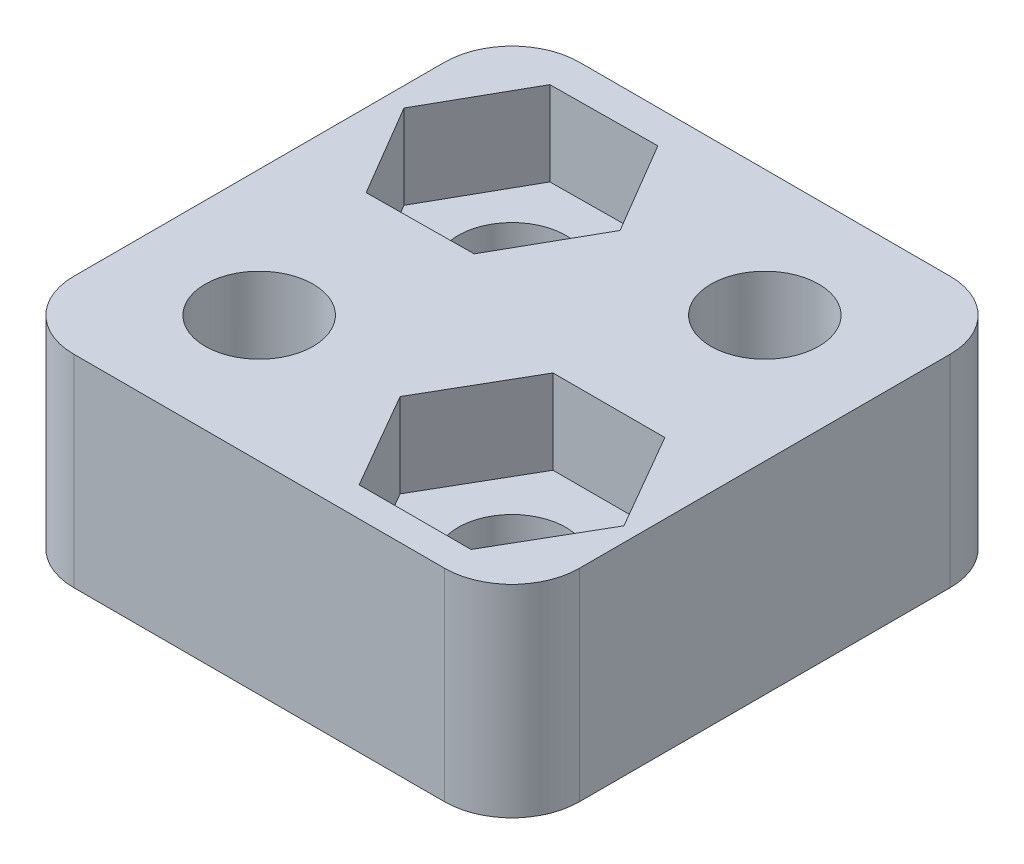
from build123d import *

# Parameters (mm, degrees)
SKETCH1_R           = 1.6
BOSS_EXTRUDE1_DEPTH = 6
CUT_EXTRUDE1_DEPTH  = 2.5
SKETCH3_R           = 2.75
CUT_EXTRUDE2_DEPTH  = 3
FILLET1_R           = 2


with BuildPart() as part:
    # Sketch1 → Boss-Extrude1 (new body)
    with BuildSketch(Plane(origin=(0, 0, 0), x_dir=(1, 0, 0), z_dir=(0, 1, 0))):
        Polygon((-7.472353521, 4.877749034), (-7.472353521, -6.298721554), (7.527646479, -6.298721554), (7.527646479, 8.701278446), (-7.472353521, 8.701278446), align=None)
        with Locations(Location((-3.722353521, 4.951278446, 0), (0, 0, 270))):
            Circle(SKETCH1_R, mode=Mode.SUBTRACT)
        with Locations(Location((3.777646479, -2.548721554, 0), (0, 0, 270))):
            Circle(SKETCH1_R, mode=Mode.SUBTRACT)
        with Locations(Location((3.777646479, 4.951278446, 0), (0, 0, 270))):
            Circle(SKETCH1_R, mode=Mode.SUBTRACT)
        with Locations(Location((-3.722353521, -2.548721554, 0), (0, 0, 270))):
            Circle(SKETCH1_R, mode=Mode.SUBTRACT)
    extrude(amount=BOSS_EXTRUDE1_DEPTH)

    # Sketch2 → Cut-Extrude1 (cut)
    with BuildSketch(Plane(origin=(0, 6, 0), x_dir=(1, 0, 0), z_dir=(0, 1, 0))):
        Polygon((-2.109264929, 2.216085852), (-0.547062955, 4.980657848), (-2.160151547, 7.715850442), (-5.335442114, 7.686471039), (-6.897644088, 4.921899043), (-5.284555496, 2.186706449), align=None)
        Polygon((7.097410526, -2.548721554), (5.437528503, 0.326278446), (2.117764455, 0.326278446), (0.457882431, -2.548721554), (2.117764455, -5.423721554), (5.437528503, -5.423721554), align=None)
    extrude(amount=-CUT_EXTRUDE1_DEPTH, mode=Mode.SUBTRACT)

    # Sketch3 → Cut-Extrude2 (cut)
    with BuildSketch(Plane.XZ):
        with Locations(Location((3.777646479, -4.951278446, 0), (0, 0, 270))):
            Circle(SKETCH3_R)
        with Locations(Location((-3.722353521, 2.548721554, 0), (0, 0, 270))):
            Circle(SKETCH3_R)
    extrude(amount=-CUT_EXTRUDE2_DEPTH, mode=Mode.SUBTRACT)

    # Fillet1
    fillet1_edges = [part.edges().sort_by_distance(p)[0] for p in [
        (-7.472353521, 3, -8.701278446),
        (7.527646479, 3, -8.701278446),
        (7.527646479, 3, 6.298721554),
        (-7.472353521, 3, 6.298721554),
    ]]
    fillet(fillet1_edges, radius=FILLET1_R)


solid = part.part
